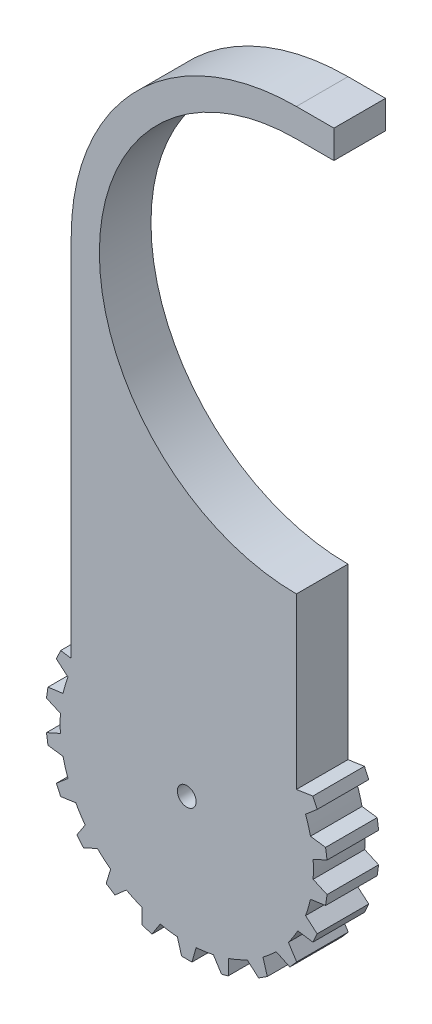
from build123d import *

# Parameters (mm, degrees)
BOSS_EXTRUDE1_DEPTH = 3
SKETCH3_W           = 3
SKETCH3_H           = 3
BOSS_EXTRUDE2_DEPTH = 4
BOSS_EXTRUDE3_START = 2.5
BOSS_EXTRUDE3_DEPTH = 2.5
CUT_EXTRUDE1_REACH  = 68.382
SKETCH5_R           = 1


with BuildPart() as part:
    # Sketch1 → Boss-Extrude1 (new body)
    with BuildSketch(Plane.XY):
        with BuildLine():
            ThreePointArc((0, -21), (-21, 0), (0, 21))
            Line((0, 21), (0, 24))
            ThreePointArc((0, 24), (-16.970562748, 16.970562748), (-24, 0))
            Line((-24, 0), (-24, -38.951706039))
            Line((-24, -38.951706039), (-25.1251405, -38.782264509))
            Line((-25.1251405, -38.782264509), (-25.583788433, -39.786563393))
            Line((-25.583788433, -39.786563393), (-24.347066616, -40.843822809))
            ThreePointArc((-24.347066616, -40.843822809), (-24.638511224, -41.723497067), (-24.868920228, -42.621092996))
            Line((-24.868920228, -42.621092996), (-26.480914421, -42.841893921))
            Line((-26.480914421, -42.841893921), (-26.638040197, -43.934727699))
            Line((-26.638040197, -43.934727699), (-25.153549904, -44.60073588))
            ThreePointArc((-25.153549904, -44.60073588), (-25.18535608, -45.526886585), (-25.153549904, -46.453037289))
            Line((-25.153549904, -46.453037289), (-26.638040197, -47.119045471))
            Line((-26.638040197, -47.119045471), (-26.48091442, -48.211879248))
            Line((-26.48091442, -48.211879248), (-24.868920228, -48.432680173))
            ThreePointArc((-24.868920228, -48.432680173), (-24.638511224, -49.330276102), (-24.347066616, -50.20995036))
            Line((-24.347066616, -50.20995036), (-25.583788433, -51.267209776))
            Line((-25.583788433, -51.267209776), (-25.1251405, -52.271508661))
            Line((-25.1251405, -52.271508661), (-23.516236589, -52.029214351))
            ThreePointArc((-23.516236589, -52.029214351), (-23.042278774, -52.82553762), (-22.514806841, -53.587469455))
            Line((-22.514806841, -53.587469455), (-23.403568337, -54.950327236))
            Line((-23.403568337, -54.950327236), (-22.680555175, -55.784728904))
            Line((-22.680555175, -55.784728904), (-21.205085373, -55.098968604))
            ThreePointArc((-21.205085373, -55.098968604), (-20.525975989, -55.729505838), (-19.805209372, -56.311968064))
            Line((-19.805209372, -56.311968064), (-20.274008375, -57.870013577))
            Line((-20.274008375, -57.870013577), (-19.674605945, -58.255226128))
            Line((-19.674605945, -58.255226128), (-19.50868057, -58.361859893))
            Line((-19.50868057, -58.361859893), (-19.345204211, -58.466919769))
            Line((-19.345204211, -58.466919769), (-18.122702306, -57.393249699))
            ThreePointArc((-18.122702306, -57.393249699), (-17.293458756, -57.806918522), (-16.437789679, -58.162723513))
            Line((-16.437789679, -58.162723513), (-16.448646882, -59.789733177))
            Line((-16.448646882, -59.789733177), (-15.747386057, -59.995641934))
            Line((-15.747386057, -59.995641934), (-15.389297906, -60.100786102))
            Line((-15.389297906, -60.100786102), (-14.518803732, -58.726188627))
            ThreePointArc((-14.518803732, -58.726188627), (-13.606606397, -58.88947605), (-12.68535608, -58.989798602))
            Line((-12.68535608, -58.989798602), (-12.237391898, -60.553961771))
            Line((-12.237391898, -60.553961771), (-11.133320263, -60.553961771))
            Line((-11.133320263, -60.553961771), (-10.68535608, -58.989798602))
            ThreePointArc((-10.68535608, -58.989798602), (-9.764105764, -58.88947605), (-8.851908429, -58.726188627))
            Line((-8.851908429, -58.726188627), (-7.986392322, -60.092925234))
            Line((-7.986392322, -60.092925234), (-7.623326104, -59.995641934))
            Line((-7.623326104, -59.995641934), (-7.262677826, -59.889746045))
            Line((-7.262677826, -59.889746045), (-7.234972221, -58.272241954))
            ThreePointArc((-7.234972221, -58.272241954), (-7.083621531, -58.21838134), (-6.932922481, -58.162723513))
            ThreePointArc((-6.932922481, -58.162723513), (-6.077253405, -57.806918522), (-5.248009855, -57.393249699))
            Line((-5.248009855, -57.393249699), (-4.025507949, -58.466919769))
            Line((-4.025507949, -58.466919769), (-3.096703786, -57.870013577))
            Line((-3.096703786, -57.870013577), (-3.565502789, -56.311968064))
            ThreePointArc((-3.565502789, -56.311968064), (-2.844736172, -55.729505838), (-2.165626787, -55.098968604))
            Line((-2.165626787, -55.098968604), (-0.690156985, -55.784728904))
            Line((-0.690156985, -55.784728904), (0.032856176, -54.950327236))
            Line((0.032856176, -54.950327236), (-0.855905319, -53.587469455))
            ThreePointArc((-0.855905319, -53.587469455), (-0.328433387, -52.82553762), (0.145524429, -52.029214351))
            Line((0.145524429, -52.029214351), (1.754428339, -52.27150866))
            Line((1.754428339, -52.27150866), (2.213076272, -51.267209776))
            Line((2.213076272, -51.267209776), (0.976354455, -50.20995036))
            ThreePointArc((0.976354455, -50.20995036), (1.267799063, -49.330276102), (1.498208067, -48.432680173))
            Line((1.498208067, -48.432680173), (3.11020226, -48.211879248))
            Line((3.11020226, -48.211879248), (3.267328036, -47.11904547))
            Line((3.267328036, -47.11904547), (1.782837743, -46.453037289))
            ThreePointArc((1.782837743, -46.453037289), (1.81464392, -45.526886584), (1.782837743, -44.60073588))
            Line((1.782837743, -44.60073588), (3.267328036, -43.934727698))
            Line((3.267328036, -43.934727698), (3.11020226, -42.84189392))
            Line((3.11020226, -42.84189392), (1.498208067, -42.621092996))
            ThreePointArc((1.498208067, -42.621092996), (1.267799063, -41.723497067), (0.976354455, -40.843822809))
            Line((0.976354455, -40.843822809), (2.213076272, -39.786563393))
            Line((2.213076272, -39.786563393), (1.754428339, -38.782264508))
            Line((1.754428339, -38.782264508), (0, -39.046474198))
            Line((0, -39.046474198), (0, -36.153828735))
            Line((0, -36.153828735), (0, -36.065527885))
            Line((0, -36.065527885), (0, -21))
        make_face()
    extrude(amount=BOSS_EXTRUDE1_DEPTH)

    # Sketch3 → Boss-Extrude2 (add)
    with BuildSketch(Plane(origin=(0, 0, 0), x_dir=(0, 0, -1), z_dir=(1, 0, 0))):
        with Locations((-1.5, 22.5)):
            Rectangle(SKETCH3_W, SKETCH3_H)
    extrude(amount=BOSS_EXTRUDE2_DEPTH)

    # Sketch4 → Boss-Extrude3 (add)
    with BuildSketch(Plane(origin=(0, 0, 0), x_dir=(-1, 0, 0), z_dir=(0, 0, -1)).offset(BOSS_EXTRUDE3_START)):
        with BuildLine():
            Line((-1.498208067, -42.621092996), (-3.11020226, -42.84189392))
            Line((-3.11020226, -42.84189392), (-3.267328036, -43.934727698))
            Line((-3.267328036, -43.934727698), (-1.782837743, -44.60073588))
            ThreePointArc((-1.782837743, -44.60073588), (-1.81464392, -45.526886584), (-1.782837743, -46.453037289))
            Line((-1.782837743, -46.453037289), (-3.267328036, -47.11904547))
            Line((-3.267328036, -47.11904547), (-3.11020226, -48.211879248))
            Line((-3.11020226, -48.211879248), (-1.498208067, -48.432680173))
            ThreePointArc((-1.498208067, -48.432680173), (-1.267799063, -49.330276102), (-0.976354455, -50.20995036))
            Line((-0.976354455, -50.20995036), (-2.213076272, -51.267209776))
            Line((-2.213076272, -51.267209776), (-1.754428339, -52.27150866))
            Line((-1.754428339, -52.27150866), (-0.145524429, -52.029214351))
            ThreePointArc((-0.145524429, -52.029214351), (0.328433387, -52.82553762), (0.855905319, -53.587469455))
            Line((0.855905319, -53.587469455), (-0.032856176, -54.950327236))
            Line((-0.032856176, -54.950327236), (0.690156985, -55.784728904))
            Line((0.690156985, -55.784728904), (2.165626787, -55.098968604))
            ThreePointArc((2.165626787, -55.098968604), (2.844736172, -55.729505838), (3.565502789, -56.311968064))
            Line((3.565502789, -56.311968064), (3.096703786, -57.870013577))
            Line((3.096703786, -57.870013577), (4.025507949, -58.466919769))
            Line((4.025507949, -58.466919769), (5.248009855, -57.393249699))
            ThreePointArc((5.248009855, -57.393249699), (6.223779069, -57.872783739), (7.234972221, -58.272241954))
            Line((7.234972221, -58.272241954), (7.262677826, -59.889746045))
            Line((7.262677826, -59.889746045), (7.623326104, -59.995641934))
            Line((7.623326104, -59.995641934), (7.986392322, -60.092925234))
            Line((7.986392322, -60.092925234), (8.851908429, -58.726188627))
            ThreePointArc((8.851908429, -58.726188627), (9.764105764, -58.88947605), (10.68535608, -58.989798602))
            Line((10.68535608, -58.989798602), (11.133320263, -60.553961771))
            Line((11.133320263, -60.553961771), (12.237391898, -60.553961771))
            Line((12.237391898, -60.553961771), (12.68535608, -58.989798602))
            ThreePointArc((12.68535608, -58.989798602), (13.606606397, -58.88947605), (14.518803732, -58.726188627))
            Line((14.518803732, -58.726188627), (15.389297906, -60.100786102))
            Line((15.389297906, -60.100786102), (16.448646882, -59.789733177))
            Line((16.448646882, -59.789733177), (16.437789679, -58.162723513))
            ThreePointArc((16.437789679, -58.162723513), (17.293458756, -57.806918522), (18.122702306, -57.393249699))
            Line((18.122702306, -57.393249699), (19.345204211, -58.466919769))
            Line((19.345204211, -58.466919769), (20.274008375, -57.870013577))
            Line((20.274008375, -57.870013577), (19.805209372, -56.311968064))
            ThreePointArc((19.805209372, -56.311968064), (20.525975989, -55.729505838), (21.205085373, -55.098968604))
            Line((21.205085373, -55.098968604), (22.680555175, -55.784728904))
            Line((22.680555175, -55.784728904), (23.403568337, -54.950327236))
            Line((23.403568337, -54.950327236), (22.514806841, -53.587469455))
            ThreePointArc((22.514806841, -53.587469455), (23.042278774, -52.82553762), (23.516236589, -52.029214351))
            Line((23.516236589, -52.029214351), (25.1251405, -52.271508661))
            Line((25.1251405, -52.271508661), (25.583788433, -51.267209776))
            Line((25.583788433, -51.267209776), (24.347066616, -50.20995036))
            ThreePointArc((24.347066616, -50.20995036), (24.638511224, -49.330276102), (24.868920228, -48.432680173))
            Line((24.868920228, -48.432680173), (26.48091442, -48.211879248))
            Line((26.48091442, -48.211879248), (26.638040197, -47.119045471))
            Line((26.638040197, -47.119045471), (25.153549904, -46.453037289))
            ThreePointArc((25.153549904, -46.453037289), (25.18535608, -45.526886585), (25.153549904, -44.60073588))
            Line((25.153549904, -44.60073588), (26.638040197, -43.934727699))
            Line((26.638040197, -43.934727699), (26.480914421, -42.841893921))
            Line((26.480914421, -42.841893921), (24.868920228, -42.621092996))
            ThreePointArc((24.868920228, -42.621092996), (24.638511224, -41.723497067), (24.347066616, -40.843822809))
            Line((24.347066616, -40.843822809), (25.583788433, -39.786563393))
            Line((25.583788433, -39.786563393), (25.1251405, -38.782264509))
            Line((25.1251405, -38.782264509), (24, -38.951706039))
            Line((24, -38.951706039), (24, 0))
            ThreePointArc((24, 0), (16.970562748, 16.970562748), (0, 24))
            Line((0, 24), (-4, 24))
            Line((-4, 24), (-4, 21))
            Line((-4, 21), (0, 21))
            ThreePointArc((0, 21), (21, 0), (0, -21))
            Line((0, -21), (0, -39.046474198))
            Line((0, -39.046474198), (-1.754428339, -38.782264508))
            Line((-1.754428339, -38.782264508), (-2.213076272, -39.786563393))
            Line((-2.213076272, -39.786563393), (-0.976354455, -40.843822809))
            ThreePointArc((-0.976354455, -40.843822809), (-1.267799063, -41.723497067), (-1.498208067, -42.621092996))
        make_face()
    extrude(amount=-BOSS_EXTRUDE3_DEPTH)

    # Sketch5 → Cut-Extrude1 (cut, up to next)
    with BuildSketch(Plane.XY.offset(3), mode=Mode.PRIVATE) as cut_extrude1_sk1:
        with Locations((-11.68535608, -45.526886584)):
            Circle(SKETCH5_R)
    cut_extrude1_tool1 = extrude(cut_extrude1_sk1.sketch, amount=-CUT_EXTRUDE1_REACH, mode=Mode.PRIVATE) & part.part
    add(cut_extrude1_tool1.solids().sort_by_distance((-11.685356, -45.526887, 3))[0], mode=Mode.SUBTRACT)


solid = part.part
